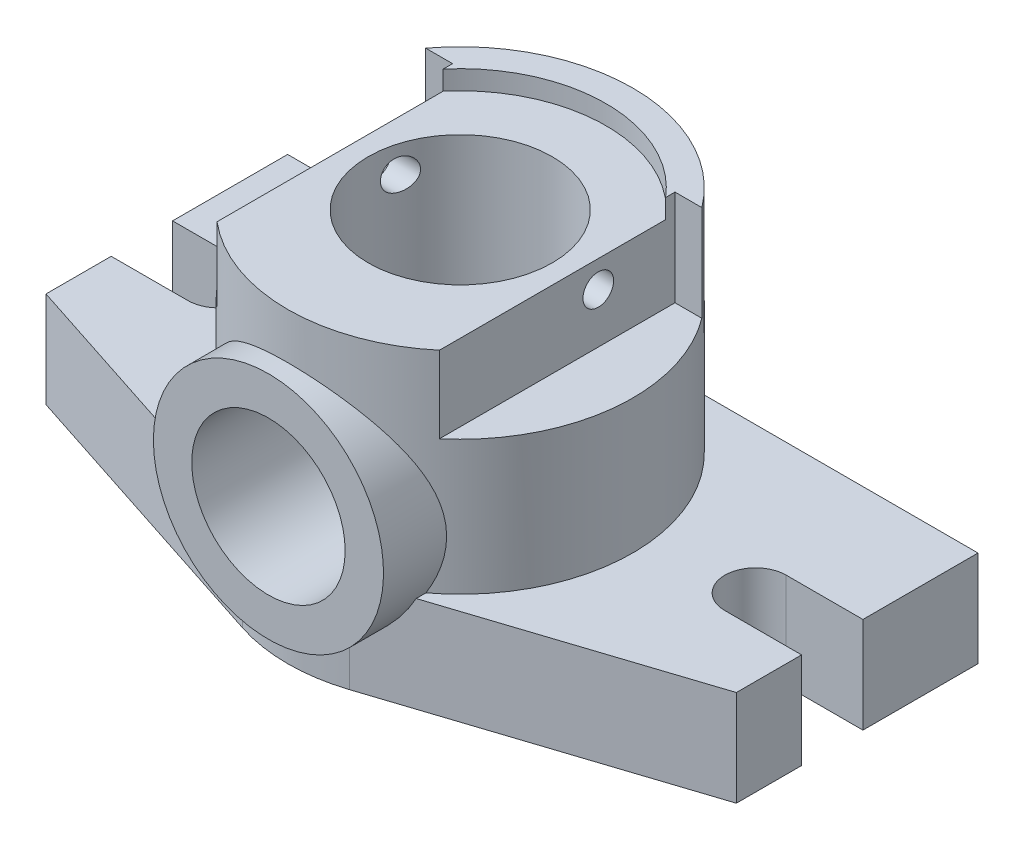
from build123d import *
from build123d.topology import SkipClean

# Parameters (mm, degrees)
EXTRUDE_1_DEPTH          = 25
SKETCH_2_R               = 45
EXTRUDE_2_DEPTH          = 60
SKETCH_3_R               = 38
CUT_EXTRUDE_1_DEPTH      = 5
SKETCH_4_R               = 24
CUT_EXTRUDE_2_DEPTH      = 132.164019457
CUT_EXTRUDE_3_DEPTH      = 121.016665509
SKETCH_7_W               = 96.437930536
SKETCH_7_H               = 64.787813211
CUT_EXTRUDE_4_DEPTH      = 132.164019457
SKETCH_8_R               = 4
CUT_EXTRUDE_5_DEPTH      = 156.20953579
EXTRUDE_3_REACH          = 158.045
SKETCH_9_R               = 30
CUT_EXTRUDE_6_REACH      = 158.045
CUT_EXTRUDE_6_END_RADIUS = 24
SKETCH_10_R              = 20


with BuildPart() as part:
    # 草图1 → 凸台-拉伸1 (new body)
    with BuildSketch(Plane(origin=(0, 0, 0), x_dir=(1, 0, 0), z_dir=(0, 1, 0))):
        with BuildLine():
            Line((-90, 38), (90, 38))
            Line((90, 38), (90, 8))
            Line((90, 8), (70, 8))
            ThreePointArc((70, 8), (62, 0), (70, -8))
            Line((70, -8), (90, -8))
            Line((90, -8), (90, -25))
            Line((90, -25), (13.942908677, -49.785456613))
            ThreePointArc((13.942908677, -49.785456613), (0, -52), (-13.942908677, -49.785456613))
            Line((-13.942908677, -49.785456613), (-90, -25))
            Line((-90, -25), (-90, -8))
            Line((-90, -8), (-70, -8))
            ThreePointArc((-70, -8), (-62, 0), (-70, 8))
            Line((-70, 8), (-90, 8))
            Line((-90, 8), (-90, 38))
        make_face()
    extrude(amount=EXTRUDE_1_DEPTH)

    # 草图2 → 凸台-拉伸2 (add)
    with SkipClean():  # the faces are left unmerged after this step: merging them gives an invalid solid
        with BuildSketch(Plane(origin=(0, 25, 0), x_dir=(1, 0, 0), z_dir=(0, 1, 0))):
            with Locations(Location((0, -7, 0), (0, 0, 90))):
                Circle(SKETCH_2_R)
        extrude(amount=EXTRUDE_2_DEPTH)

    # 草图3 → 切除-拉伸1 (cut)
    with SkipClean():  # the faces are left unmerged after this step: merging them gives an invalid solid
        with BuildSketch(Plane(origin=(0, 85, 0), x_dir=(1, 0, 0), z_dir=(0, 1, 0))):
            with Locations(Location((0, -7, 0), (0, 0, 270))):
                Circle(SKETCH_3_R)
        extrude(amount=-CUT_EXTRUDE_1_DEPTH, mode=Mode.SUBTRACT)

    # 草图4 → 切除-拉伸2 (cut, through all)
    with SkipClean():  # the faces are left unmerged after this step: merging them gives an invalid solid
        with BuildSketch(Plane(origin=(0, 80, 0), x_dir=(1, 0, 0), z_dir=(0, 1, 0))):
            with Locations(Location((0, -7, 0), (0, 0, 270))):
                Circle(SKETCH_4_R)
        extrude(amount=-CUT_EXTRUDE_2_DEPTH, mode=Mode.SUBTRACT)

    # 草图5 → 切除-拉伸3 (cut, through all)
    with SkipClean():  # the faces are left unmerged after this step: merging them gives an invalid solid
        with BuildSketch(Plane(origin=(0, 60, 0), x_dir=(1, 0, 0), z_dir=(0, 1, 0))):
            with BuildLine():
                Line((-29, 20), (-29, -41.409301068))
                ThreePointArc((-29, -41.409301068), (-44.710463702, -12.096512099), (-36, 20))
                Line((-36, 20), (-29, 20))
            make_face()
            with BuildLine():
                Line((29, 20), (29, -41.409301068))
                ThreePointArc((29, -41.409301068), (44.710463702, -12.096512099), (36, 20))
                Line((36, 20), (29, 20))
            make_face()
        extrude(amount=CUT_EXTRUDE_3_DEPTH, mode=Mode.SUBTRACT)

    # 草图7 → 切除-拉伸4 (cut, through all)
    with SkipClean():  # the faces are left unmerged after this step: merging them gives an invalid solid
        with BuildSketch(Plane(origin=(0, 80, 0), x_dir=(1, 0, 0), z_dir=(0, 1, 0))):
            with Locations((0.609746756, -32.393906605)):
                Rectangle(SKETCH_7_W, SKETCH_7_H)
        extrude(amount=CUT_EXTRUDE_4_DEPTH, mode=Mode.SUBTRACT)

    # 草图8 → 切除-拉伸5 (cut, through all)
    with SkipClean():  # the faces are left unmerged after this step: merging them gives an invalid solid
        with BuildSketch(Plane.ZY.offset(29)):
            with Locations((0, 73)):
                Circle(SKETCH_8_R)
        extrude(amount=-CUT_EXTRUDE_5_DEPTH, mode=Mode.SUBTRACT)

    # 草图9 → 凸台-拉伸3 (add, up to next)
    with BuildSketch(Plane(origin=(0, 0, 57), x_dir=(-1, 0, 0), z_dir=(0, 0, -1)), mode=Mode.PRIVATE) as extrude_3_sk1:
        with Locations(Location((0, 38, 0), (0, 0, 205.679288619))):
            Circle(SKETCH_9_R)
    extrude_3_tool1 = extrude(extrude_3_sk1.sketch, amount=EXTRUDE_3_REACH, mode=Mode.PRIVATE) - part.part
    add(extrude_3_tool1.solids().sort_by_distance((0, 38, 57))[0])

    # 切除-拉伸6: up to this cylinder (the profile starts outside it)
    cut_extrude_6_end = Plane(origin=(0, 38, 7), z_dir=(0, 1, 0)) * Cylinder(CUT_EXTRUDE_6_END_RADIUS, 365.09, mode=Mode.PRIVATE)
    # 草图10 → 切除-拉伸6 (cut, up to the surface)
    with BuildSketch(Plane.XY.offset(57), mode=Mode.PRIVATE) as cut_extrude_6_sk1:
        with Locations((0, 38)):
            Circle(SKETCH_10_R)
    cut_extrude_6_tool1 = extrude(cut_extrude_6_sk1.sketch, amount=-CUT_EXTRUDE_6_REACH, mode=Mode.PRIVATE) - cut_extrude_6_end
    add(cut_extrude_6_tool1.solids().sort_by_distance((0, 38, 57))[0], mode=Mode.SUBTRACT)


solid = part.part
